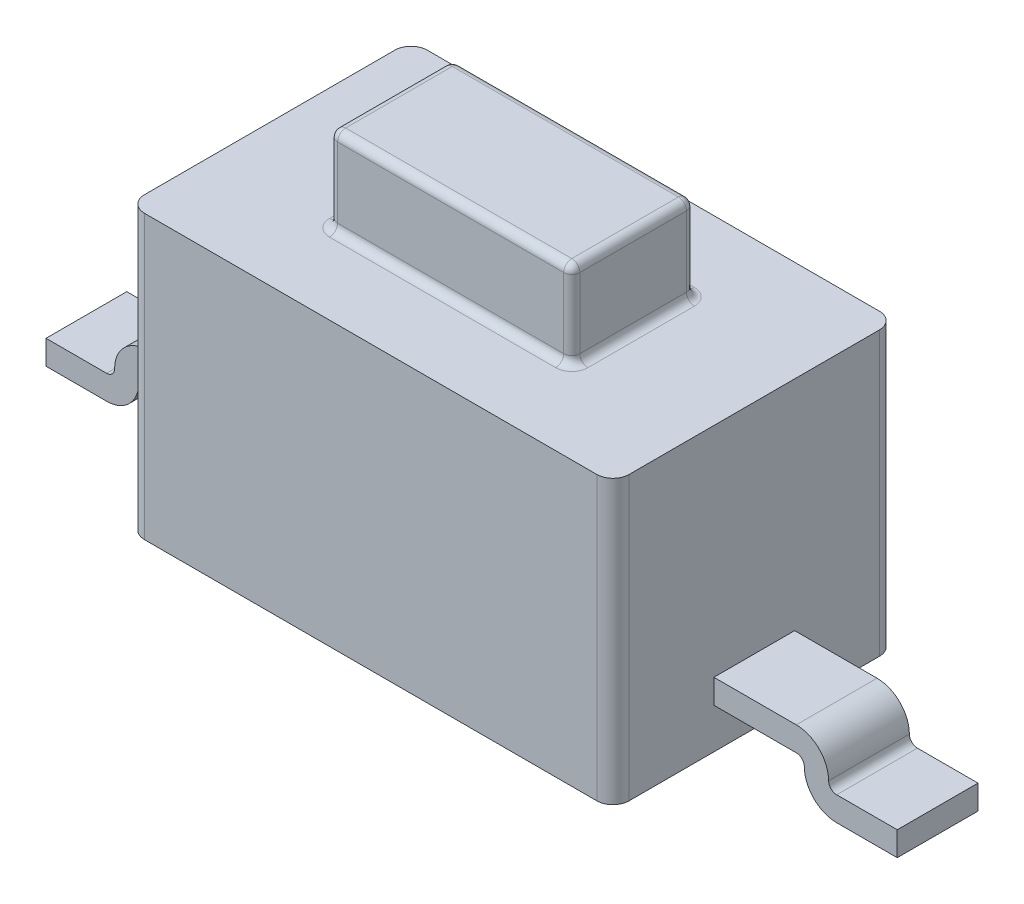
from build123d import *

# Parameters (mm, degrees)
SKETCH1_W           = 6
SKETCH1_H           = 3.5
BOSS_EXTRUDE1_DEPTH = 3.5
FILLET1_R           = 0.2
SKETCH2_W           = 3
SKETCH2_H           = 1.52
BOSS_EXTRUDE2_DEPTH = 1.07
FILLET2_R           = 0.1
SKETCH3_W           = 1
SKETCH3_H           = 0.3
CIRPATTERN1_COUNT   = 2


with BuildPart() as part:
    # Sketch1 → Boss-Extrude1 (new body)
    with BuildSketch(Plane(origin=(0, 0, 0), x_dir=(1, 0, 0), z_dir=(0, 1, 0))):
        Rectangle(SKETCH1_W, SKETCH1_H)
    extrude(amount=BOSS_EXTRUDE1_DEPTH)

    # Fillet1
    fillet1_edges = [part.edges().sort_by_distance(p)[0] for p in [
        (-3, 1.75, -1.75),
        (3, 1.75, -1.75),
        (3, 1.75, 1.75),
        (-3, 1.75, 1.75),
    ]]
    fillet(fillet1_edges, radius=FILLET1_R)

    # Sketch2 → Boss-Extrude2 (add)
    with BuildSketch(Plane(origin=(0, 3.5, 0), x_dir=(1, 0, 0), z_dir=(0, 1, 0))):
        Rectangle(SKETCH2_W, SKETCH2_H)
    extrude(amount=BOSS_EXTRUDE2_DEPTH)

    # Fillet2
    fillet2_edges = [part.edges().sort_by_distance(p)[0] for p in [
        (1.5, 3.5, 0),
        (1.5, 4.035, -0.76),
        (0, 3.5, -0.76),
        (-1.5, 4.035, -0.76),
        (-1.5, 3.5, 0),
        (-1.5, 4.035, 0.76),
        (1.5, 4.035, 0.76),
        (0, 3.5, 0.76),
        (0, 4.57, 0.76),
        (-1.5, 4.57, 0),
        (0, 4.57, -0.76),
        (1.5, 4.57, 0),
    ]]
    fillet(fillet2_edges, radius=FILLET2_R)

    # Sweep1: sweep along a path in Sketch4
    with BuildLine(Plane.XY) as sweep1_path:
        Line((3, 0.65), (4.02, 0.65))
        ThreePointArc((4.02, 0.65), (4.196776695, 0.576776695), (4.27, 0.4))
        ThreePointArc((4.27, 0.4), (4.343223305, 0.223223305), (4.52, 0.15))
        Line((4.52, 0.15), (5.27, 0.15))
    # Sketch3 → Sweep1 (sweep)
    with BuildSketch(Plane(origin=(3, 0, 0), x_dir=(0, 0, -1), z_dir=(1, 0, 0))):
        with Locations((0, 0.65)):
            Rectangle(SKETCH3_W, SKETCH3_H)
    sweep1 = sweep(path=sweep1_path.line)

    # CirPattern1: Sweep1 ×2 about axis
    cirpattern1_axis = Axis((0, 4.7985, 0), (0, -1, 0))
    for i in range(1, CIRPATTERN1_COUNT):
        add(sweep1.rotate(cirpattern1_axis, i * 360 / CIRPATTERN1_COUNT))


solid = part.part
